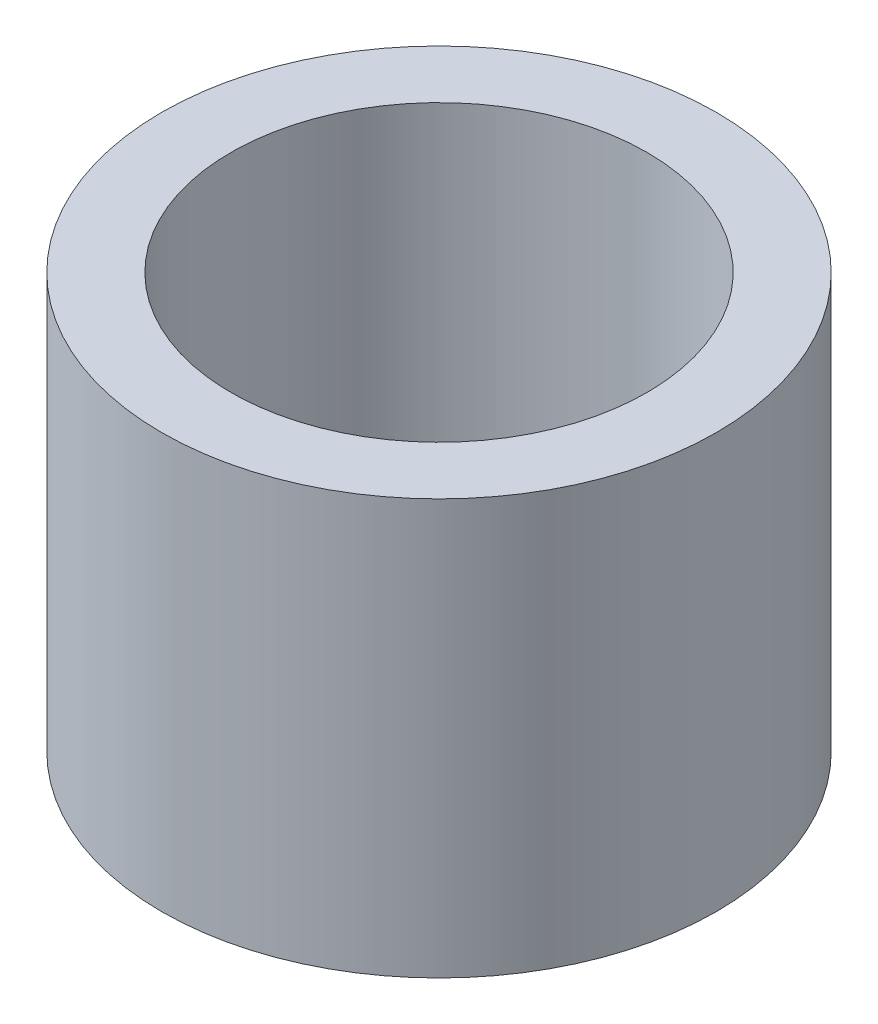
from build123d import *

# Parameters (mm, degrees)
SKETCH1_R           = 12.7
BOSS_EXTRUDE1_DEPTH = 19
SKETCH2_R           = 9.525
CUT_EXTRUDE1_DEPTH  = 19


with BuildPart() as part:
    # Sketch1 → Boss-Extrude1 (new body)
    with BuildSketch(Plane(origin=(0, 0, 0), x_dir=(1, 0, 0), z_dir=(0, 1, 0))):
        with Locations(Location((0, 0, 0), (0, 0, 270))):
            Circle(SKETCH1_R)
    extrude(amount=BOSS_EXTRUDE1_DEPTH)

    # Sketch2 → Cut-Extrude1 (cut)
    with BuildSketch(Plane.XZ):
        with Locations(Location((0, 0, 0), (0, 0, 270))):
            Circle(SKETCH2_R)
    extrude(amount=-CUT_EXTRUDE1_DEPTH, mode=Mode.SUBTRACT)


solid = part.part
